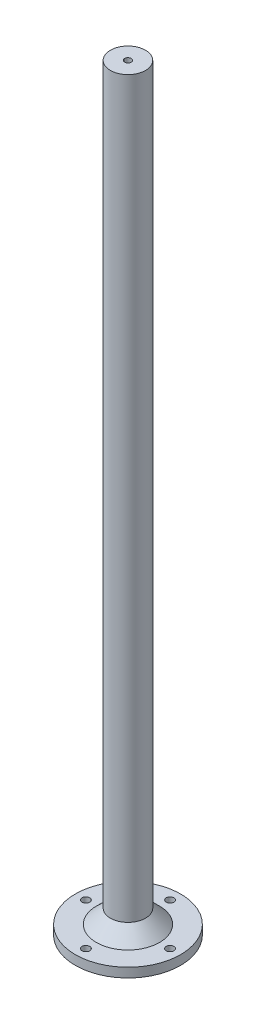
from build123d import *

# Parameters (mm, degrees)
SKETCH_1_R          = 22.5
SKETCH_1_R_2        = 1.65
EXTRUDE_1_DEPTH     = 4
SKETCH_2_R          = 7.5
EXTRUDE_2_DEPTH     = 320
SKETCH_3_R          = 1.4
CUT_EXTRUDE_1_DEPTH = 10
CHAMFER_1_SIZE      = 6


with BuildPart() as part:
    # 草图1 → 凸台-拉伸1 (new body)
    with BuildSketch(Plane(origin=(0, 0, 0), x_dir=(1, 0, 0), z_dir=(0, 1, 0))):
        with Locations(Location((0, 0, 0), (0, 0, 270))):
            Circle(SKETCH_1_R)
        with Locations(Location((-18, 0, 0), (0, 0, 270))):
            Circle(SKETCH_1_R_2, mode=Mode.SUBTRACT)
        with Locations(Location((18, 0, 0), (0, 0, 270))):
            Circle(SKETCH_1_R_2, mode=Mode.SUBTRACT)
        with Locations(Location((0, 18, 0), (0, 0, 270))):
            Circle(SKETCH_1_R_2, mode=Mode.SUBTRACT)
        with Locations(Location((0, -18, 0), (0, 0, 270))):
            Circle(SKETCH_1_R_2, mode=Mode.SUBTRACT)
    extrude(amount=EXTRUDE_1_DEPTH)

    # 草图2 → 凸台-拉伸2 (add)
    with BuildSketch(Plane(origin=(0, 4, 0), x_dir=(1, 0, 0), z_dir=(0, 1, 0))):
        with Locations(Location((0, 0, 0), (0, 0, 270))):
            Circle(SKETCH_2_R)
    extrude(amount=EXTRUDE_2_DEPTH)

    # 草图3 → 切除-拉伸1 (cut)
    with BuildSketch(Plane(origin=(0, 324, 0), x_dir=(1, 0, 0), z_dir=(0, 1, 0))):
        with Locations(Location((0, 0, 0), (0, 0, 270))):
            Circle(SKETCH_3_R)
    extrude(amount=-CUT_EXTRUDE_1_DEPTH, mode=Mode.SUBTRACT)

    # 倒角1
    chamfer_1_edges = [part.edges().sort_by_distance(p)[0] for p in [
        (0, 4, -7.5),
    ]]
    chamfer(chamfer_1_edges, length=CHAMFER_1_SIZE)


solid = part.part
